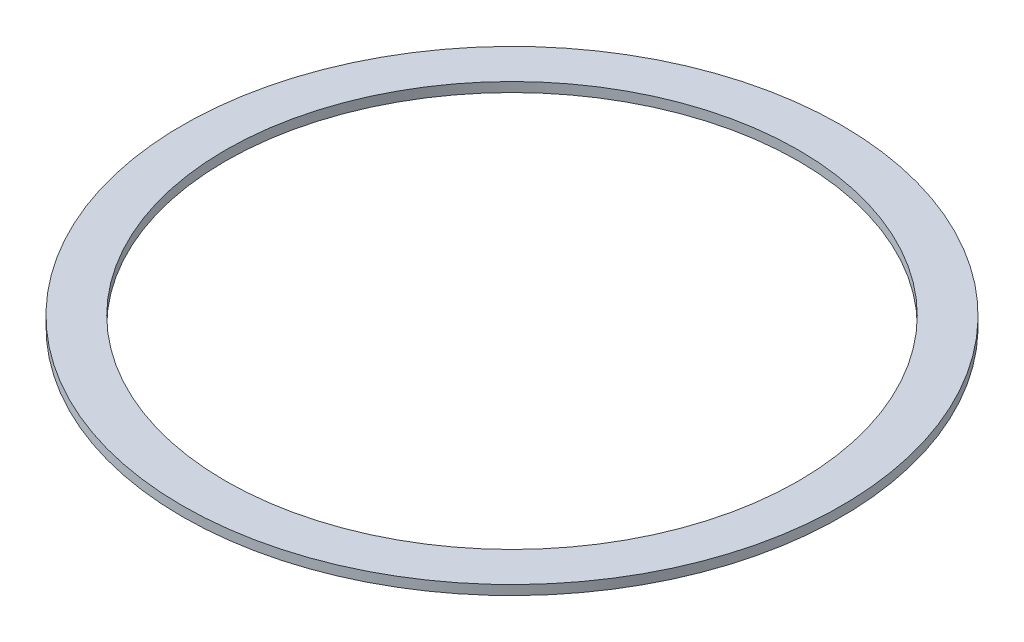
from build123d import *

# Parameters (mm, degrees)
SKETCH1_R           = 69
SKETCH1_R_2         = 60
BOSS_EXTRUDE1_DEPTH = 2


with BuildPart() as part:
    # Sketch1 → Boss-Extrude1 (new body)
    with BuildSketch(Plane(origin=(0, 0, 0), x_dir=(1, 0, 0), z_dir=(0, 1, 0))):
        with Locations(Location((0, 0, 0), (0, 0, 270))):
            Circle(SKETCH1_R)
        with Locations(Location((0, 0, 0), (0, 0, 270))):
            Circle(SKETCH1_R_2, mode=Mode.SUBTRACT)
    extrude(amount=BOSS_EXTRUDE1_DEPTH)


solid = part.part
